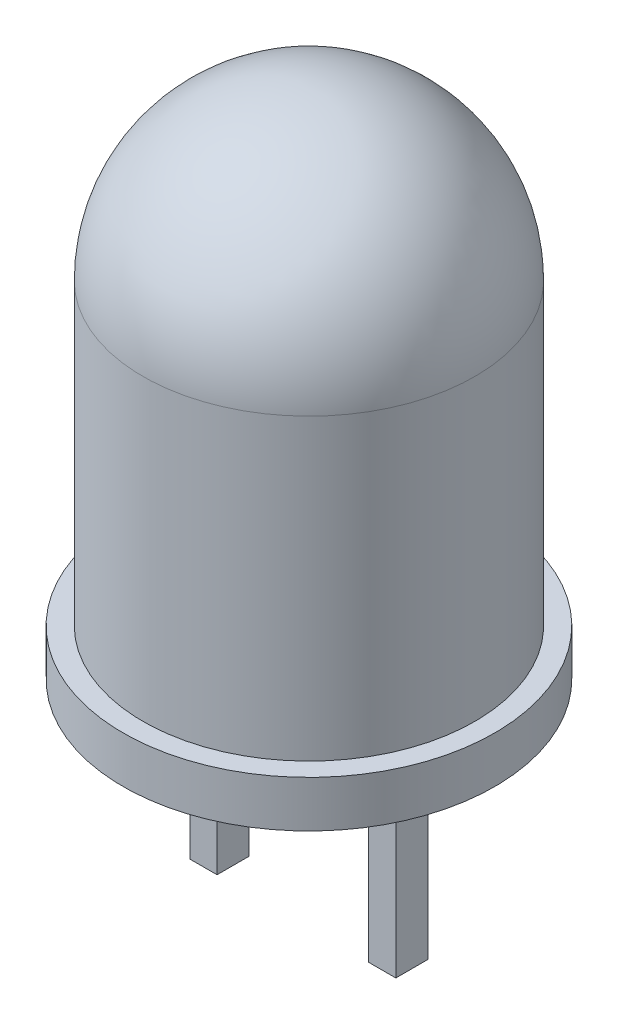
from build123d import *

# Parameters (mm, degrees)
SKETCH2_R           = 2.5
BOSS_EXTRUDE1_DEPTH = 7
SKETCH3_R           = 2.8
BOSS_EXTRUDE2_DEPTH = 0.7
FILLET1_R           = 2.5
SKETCH4_W           = 0.409361502
SKETCH4_H           = 0.4847702
BOSS_EXTRUDE3_DEPTH = 3


with BuildPart() as part:
    # Sketch2 → Boss-Extrude1 (new body)
    with BuildSketch(Plane(origin=(0, 0, 0), x_dir=(1, 0, 0), z_dir=(0, 1, 0))):
        with Locations(Location((0, 0, 0), (0, 0, 270))):
            Circle(SKETCH2_R)
    extrude(amount=BOSS_EXTRUDE1_DEPTH)

    # Sketch3 → Boss-Extrude2 (add)
    with BuildSketch(Plane.XZ):
        with Locations(Location((0, 0, 0), (0, 0, 270))):
            Circle(SKETCH3_R)
    extrude(amount=BOSS_EXTRUDE2_DEPTH)

    # Fillet1
    fillet1_edges = [part.edges().sort_by_distance(p)[0] for p in [
        (0, 7, -2.5),
    ]]
    fillet(fillet1_edges, radius=FILLET1_R)

    # Sketch4 → Boss-Extrude3 (add)
    with BuildSketch(Plane.XZ.offset(0.7)):
        with Locations((1.346583888, 0)):
            Rectangle(SKETCH4_W, SKETCH4_H)
        with Locations((-1.346583888, 0)):
            Rectangle(SKETCH4_W, SKETCH4_H)
    extrude(amount=BOSS_EXTRUDE3_DEPTH)


solid = part.part
